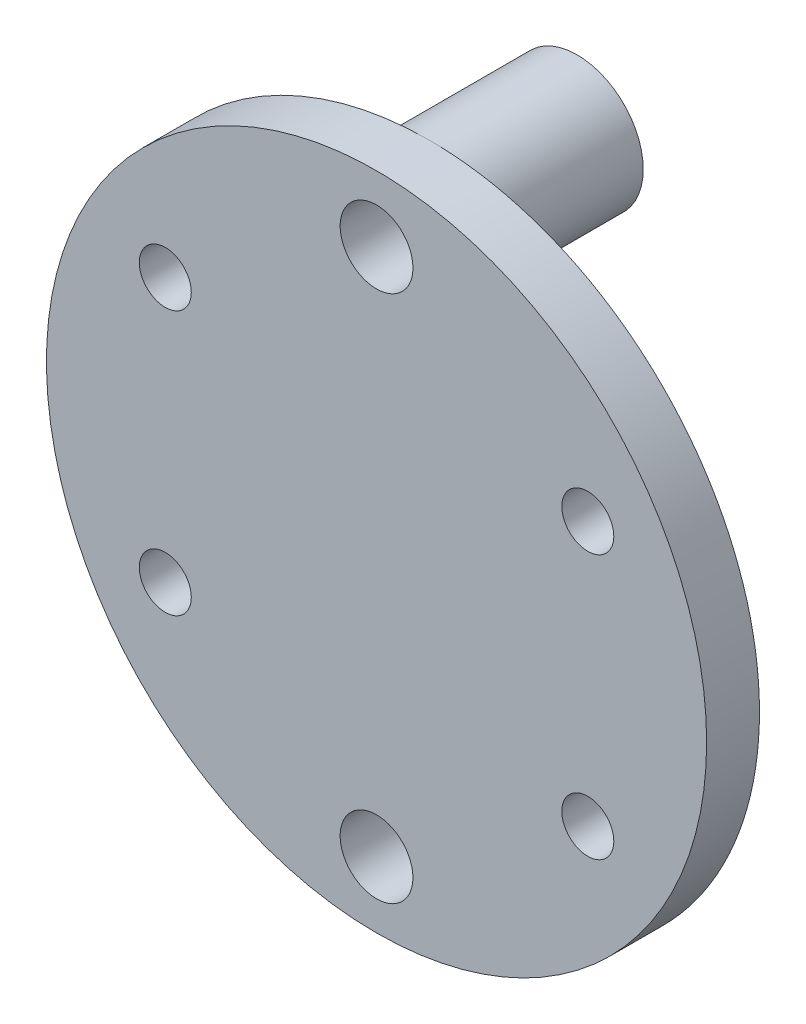
from build123d import *

# Parameters (mm, degrees)
SKETCH1_R           = 15.875
SKETCH1_R_2         = 1.75
SKETCH1_R_3         = 1.25
BOSS_EXTRUDE1_DEPTH = 2.54
BOSS_EXTRUDE2_START = -7.110000004
SKETCH1_3_R         = 3.175
SKETCH1_3_R_2       = 1.75
BOSS_EXTRUDE2_DEPTH = 7.110000004


with BuildPart() as part:
    # Sketch1 → Boss-Extrude1 (new body)
    with BuildSketch(Plane.XY):
        Circle(SKETCH1_R)
        with Locations((0, 12.7)):
            Circle(SKETCH1_R_2, mode=Mode.SUBTRACT)
        with Locations((-10.16, -6.35)):
            Circle(SKETCH1_R_3, mode=Mode.SUBTRACT)
        with Locations((10.16, -6.35)):
            Circle(SKETCH1_R_3, mode=Mode.SUBTRACT)
        with Locations((-10.16, 6.35)):
            Circle(SKETCH1_R_3, mode=Mode.SUBTRACT)
        with Locations((10.16, 6.35)):
            Circle(SKETCH1_R_3, mode=Mode.SUBTRACT)
        with Locations((0, -12.7)):
            Circle(SKETCH1_R_2, mode=Mode.SUBTRACT)
    extrude(amount=BOSS_EXTRUDE1_DEPTH)

    # Sketch1<3> → Boss-Extrude2 (add)
    # profile 1 of 2: a face of its own
    with BuildSketch(Plane.XY.offset(BOSS_EXTRUDE2_START)):
        with Locations((0, 12.7)):
            Circle(SKETCH1_3_R)
        with Locations((0, 12.7)):
            Circle(SKETCH1_3_R_2, mode=Mode.SUBTRACT)
    # profile 2 of 2: a face of its own
    with BuildSketch(Plane.XY.offset(BOSS_EXTRUDE2_START)):
        with Locations((0, -12.7)):
            Circle(SKETCH1_3_R)
        with Locations((0, -12.7)):
            Circle(SKETCH1_3_R_2, mode=Mode.SUBTRACT)
    extrude(amount=BOSS_EXTRUDE2_DEPTH)


solid = part.part
